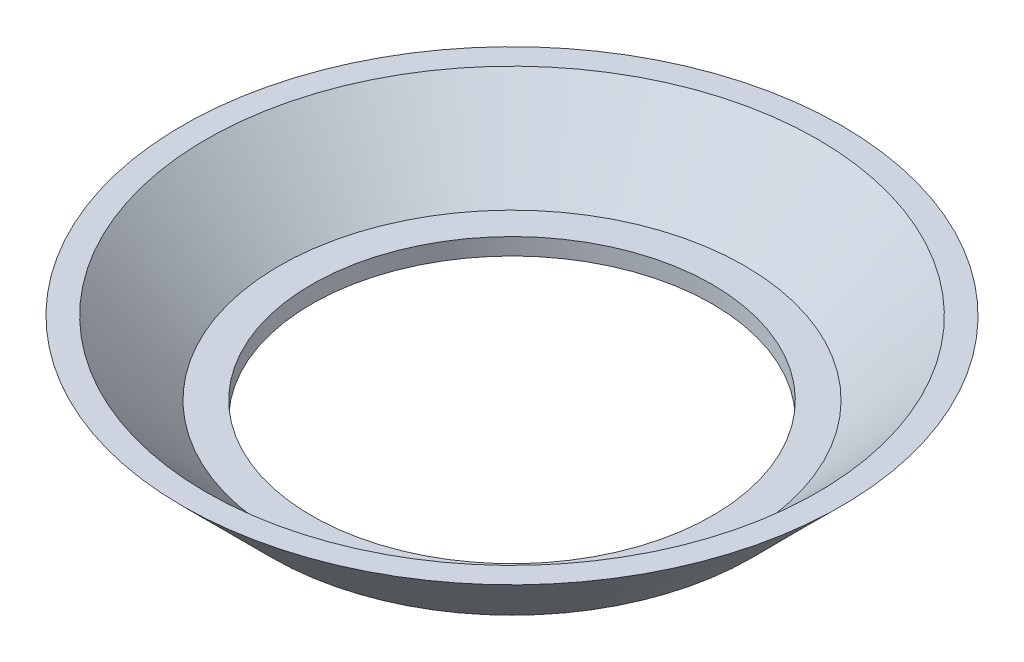
from build123d import *


with BuildPart() as part:
    # Skizze1 → Rotation1 (revolve)
    with BuildSketch(Plane.XY, mode=Mode.PRIVATE) as rotation1_sk:
        Polygon((35.66, 0), (42.66, 0), (58.66, 16), (54.417359313, 16), (41.417359313, 3), (35.66, 3), align=None)
    revolve(rotation1_sk.sketch.rotate(Axis((0, -7.798563139, 0), (0, 1, 0)), 90), axis=Axis((0, -7.798563139, 0), (0, 1, 0)))


solid = part.part
